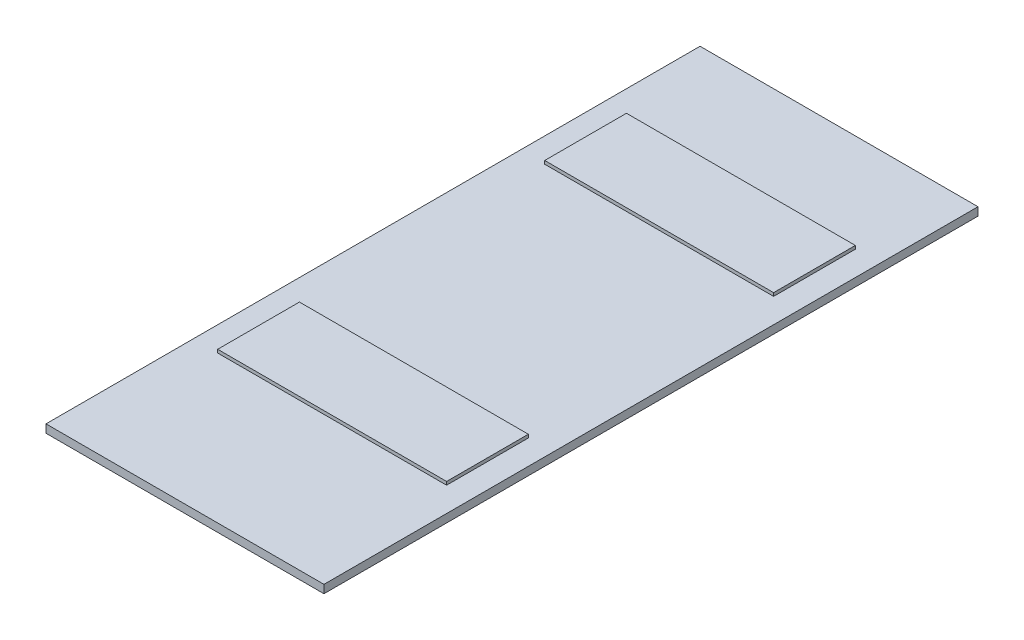
from build123d import *

# Parameters (mm, degrees)
SKETCH1_W           = 85
SKETCH1_H           = 200
BOSS_EXTRUDE1_DEPTH = 2.5
SKETCH2_W           = 70
SKETCH2_H           = 25
BOSS_EXTRUDE2_DEPTH = 1


with BuildPart() as part:
    # Sketch1 → Boss-Extrude1 (new body)
    with BuildSketch(Plane(origin=(0, 0, 0), x_dir=(1, 0, 0), z_dir=(0, 1, 0))):
        with Locations((42.5, 100)):
            Rectangle(SKETCH1_W, SKETCH1_H)
    extrude(amount=BOSS_EXTRUDE1_DEPTH)

    # Sketch2 → Boss-Extrude2 (add)
    with BuildSketch(Plane(origin=(0, 2.5, 0), x_dir=(1, 0, 0), z_dir=(0, 1, 0))):
        with Locations((42.5, 157.5)):
            Rectangle(SKETCH2_W, SKETCH2_H)
        with Locations((42.5, 57.5)):
            Rectangle(SKETCH2_W, SKETCH2_H)
    extrude(amount=BOSS_EXTRUDE2_DEPTH)


solid = part.part
